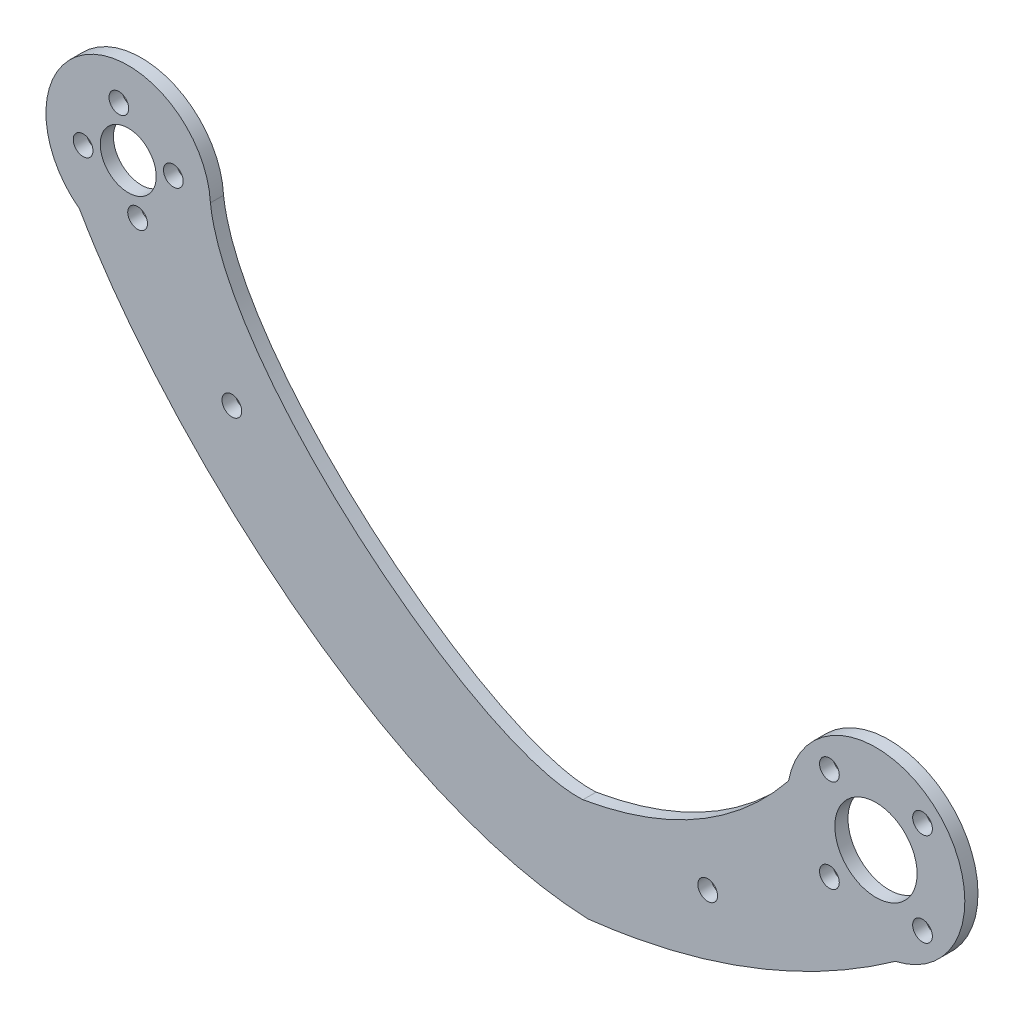
from build123d import *

# Parameters (mm, degrees)
SKETCH_1_R          = 13.5
EXTRUDE_1_DEPTH     = 2
SKETCH_2_R          = 6.25
SKETCH_2_R_2        = 1.5
SKETCH_2_R_3        = 4.25
CUT_EXTRUDE_2_DEPTH = 135.372484569
SKETCH_3_R          = 1.5
CUT_EXTRUDE_3_DEPTH = 135.372484569


with BuildPart() as part:
    # 草图1 → 凸台-拉伸1 (new body)
    with BuildSketch(Plane.XY):
        Circle(SKETCH_1_R)
        with BuildLine():
            ThreePointArc((5.892711217, -11.0238811), (8.326059469, 9.323450741), (-11.617581648, 4.613219771))
            add(Edge.make_bspline(
                [(-44.514894976, -15.648119029), (-23.754992487, -12.049932399), (-11.617581648, 4.613219771)],
                knots=[0, 0, 0, 1, 1, 1], degree=2))
            add(Edge.make_bspline(
                [(-44.514894976, -15.648119029), (-60.493246192, -16.620966096), (-98.719374485, 13.99401616), (-101.099323327, 34.577284328)],
                knots=[0, 0, 0, 0, 1, 1, 1, 1], degree=3))
            ThreePointArc((-101.099323327, 34.577284328), (-119.514224633, 44.92723863), (-120.988196928, 23.854565571))
            add(Edge.make_bspline(
                [(-43.715031798, -30.941916126), (-74.6558876, -29.772176263), (-107.934743734, 0.909272839), (-120.988196928, 23.854565571)],
                knots=[0, 0, 0, 0, 1, 1, 1, 1], degree=3))
            add(Edge.make_bspline(
                [(5.892711217, -11.0238811), (-16.208282922, -27.819747246), (-43.715031798, -30.941916126)],
                knots=[0, 0, 0, 1, 1, 1], degree=2))
        make_face()
    extrude(amount=EXTRUDE_1_DEPTH)

    # 草图2 → 切除-拉伸2 (cut, through all)
    with BuildSketch(Plane.XY):
        Circle(SKETCH_2_R)
        with Locations((-7.071067812, 7.071067812)):
            Circle(SKETCH_2_R_2)
        with Locations((7.071067812, 7.071067812)):
            Circle(SKETCH_2_R_2)
        with Locations((7.071067812, -7.071067812)):
            Circle(SKETCH_2_R_2)
        with Locations((-7.071067812, -7.071067812)):
            Circle(SKETCH_2_R_2)
        with Locations((-113.582262859, 33.924428557)):
            Circle(SKETCH_2_R_3)
        with Locations((-106.728711554, 35.34880018)):
            Circle(SKETCH_2_R_2)
        with Locations((-112.157891236, 27.070877253)):
            Circle(SKETCH_2_R_2)
        with Locations((-120.435814163, 32.500056934)):
            Circle(SKETCH_2_R_2)
        with Locations((-115.006634481, 40.777979862)):
            Circle(SKETCH_2_R_2)
    extrude(amount=CUT_EXTRUDE_2_DEPTH, mode=Mode.SUBTRACT)

    # 草图3 → 切除-拉伸3 (cut, through all)
    with BuildSketch(Plane.XY):
        with Locations((-97.840235061, 9.542968429)):
            Circle(SKETCH_3_R)
        with Locations((-25.561724323, -18.05130401)):
            Circle(SKETCH_3_R)
    extrude(amount=CUT_EXTRUDE_3_DEPTH, mode=Mode.SUBTRACT)


solid = part.part
